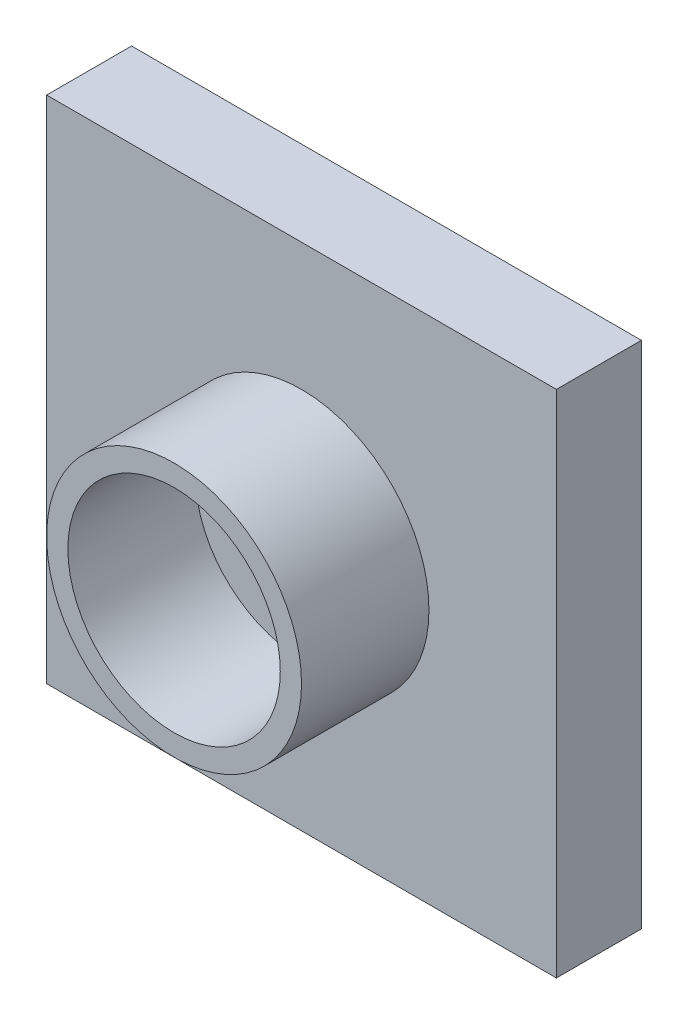
from build123d import *

# Parameters (mm, degrees)
SKETCH1_W           = 12
SKETCH1_H           = 12
BOSS_EXTRUDE1_DEPTH = 2
SKETCH2_R           = 3
SKETCH2_R_2         = 2.5
BOSS_EXTRUDE2_DEPTH = 3


with BuildPart() as part:
    # Sketch1 → Boss-Extrude1 (new body)
    with BuildSketch(Plane.XY):
        Rectangle(SKETCH1_W, SKETCH1_H)
    extrude(amount=BOSS_EXTRUDE1_DEPTH)

    # Sketch2 → Boss-Extrude2 (add)
    with BuildSketch(Plane.XY.offset(2)):
        Circle(SKETCH2_R)
        Circle(SKETCH2_R_2, mode=Mode.SUBTRACT)
    extrude(amount=BOSS_EXTRUDE2_DEPTH)


solid = part.part
